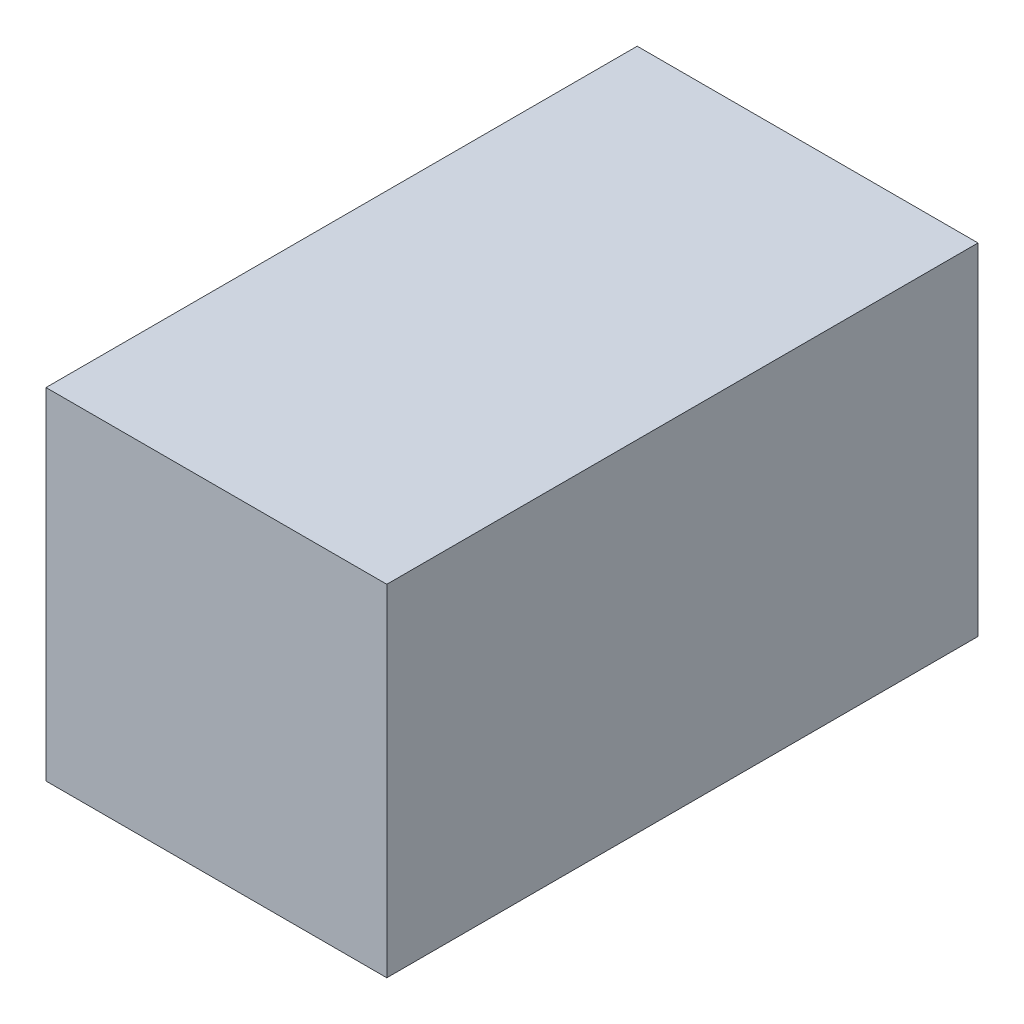
from build123d import *

# Parameters (mm, degrees)
BOSS_EXTRUDE1_DEPTH      = 12.25
BOSS_EXTRUDE1_DEPTH_BACK = 12.25
SKETCH2_W                = 42.5
SKETCH2_H                = 24.5


with BuildPart() as part:
    # Sketch2 → Boss-Extrude1 (new, two sides: drawn at the far end of the back side and taken through both)
    with BuildSketch(Plane(origin=(0, 0, 0), x_dir=(0, 0, -1), z_dir=(1, 0, 0)).offset(-BOSS_EXTRUDE1_DEPTH_BACK)):
        with Locations((21.25, 12.25)):
            Rectangle(SKETCH2_W, SKETCH2_H)
    extrude(amount=BOSS_EXTRUDE1_DEPTH + BOSS_EXTRUDE1_DEPTH_BACK)


solid = part.part
